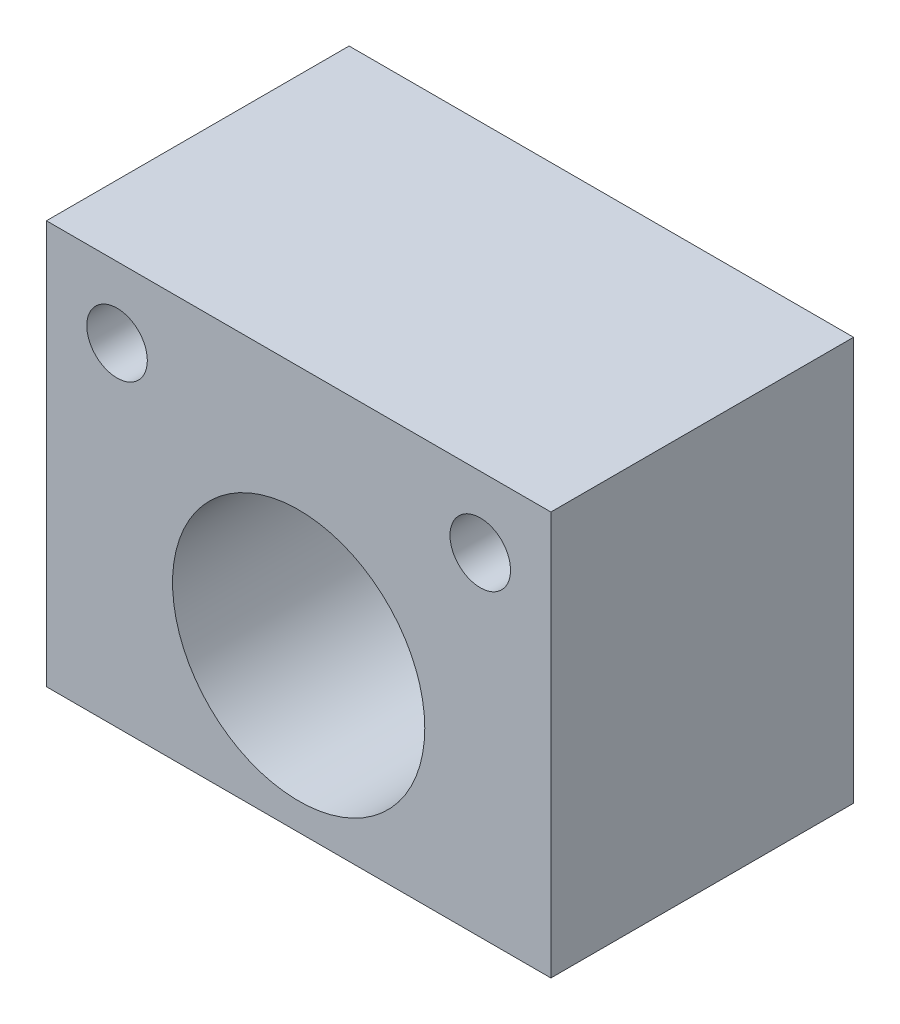
from build123d import *

# Parameters (mm, degrees)
CROQUIS1_W              = 50
CROQUIS1_H              = 40
CROQUIS1_R              = 12.5
SALIENTE_EXTRUIR1_DEPTH = 30
CROQUIS2_R              = 3
CORTAR_EXTRUIR1_DEPTH   = 30
SALIENTE_EXTRUIR2_START = -30
CROQUIS3_R              = 12.5
SALIENTE_EXTRUIR2_DEPTH = 30
CROQUIS4_R              = 12.5
CORTAR_EXTRUIR2_DEPTH   = 20.1
CROQUIS5_R              = 12.5
CORTAR_EXTRUIR3_DEPTH   = 9.9


with BuildPart() as part:
    # Croquis1 → Saliente-Extruir1 (new body)
    with BuildSketch(Plane.XY):
        Rectangle(CROQUIS1_W, CROQUIS1_H)
        Circle(CROQUIS1_R, mode=Mode.SUBTRACT)
    extrude(amount=SALIENTE_EXTRUIR1_DEPTH)

    # Croquis2 → Cortar-Extruir1 (cut)
    with BuildSketch(Plane.XY.offset(30)):
        with Locations((-18, 13)):
            Circle(CROQUIS2_R)
        with Locations(Location((18, 13, 0), (0, 0, 180))):
            Circle(CROQUIS2_R)
    extrude(amount=-CORTAR_EXTRUIR1_DEPTH, mode=Mode.SUBTRACT)

    # Croquis3 → Saliente-Extruir2 (add)
    with BuildSketch(Plane.XY.offset(30).offset(SALIENTE_EXTRUIR2_START)):
        Circle(CROQUIS3_R)
    extrude(amount=SALIENTE_EXTRUIR2_DEPTH)

    # Croquis4 → Cortar-Extruir2 (cut)
    with BuildSketch(Plane.XY.offset(30)):
        with Locations((0, -4.809057324)):
            Circle(CROQUIS4_R)
    extrude(amount=-CORTAR_EXTRUIR2_DEPTH, mode=Mode.SUBTRACT)

    # Croquis5 → Cortar-Extruir3 (cut)
    with BuildSketch(Plane.XY.offset(9.9)):
        with Locations((0, -4.809057324)):
            Circle(CROQUIS5_R)
    extrude(amount=-CORTAR_EXTRUIR3_DEPTH, mode=Mode.SUBTRACT)


solid = part.part
